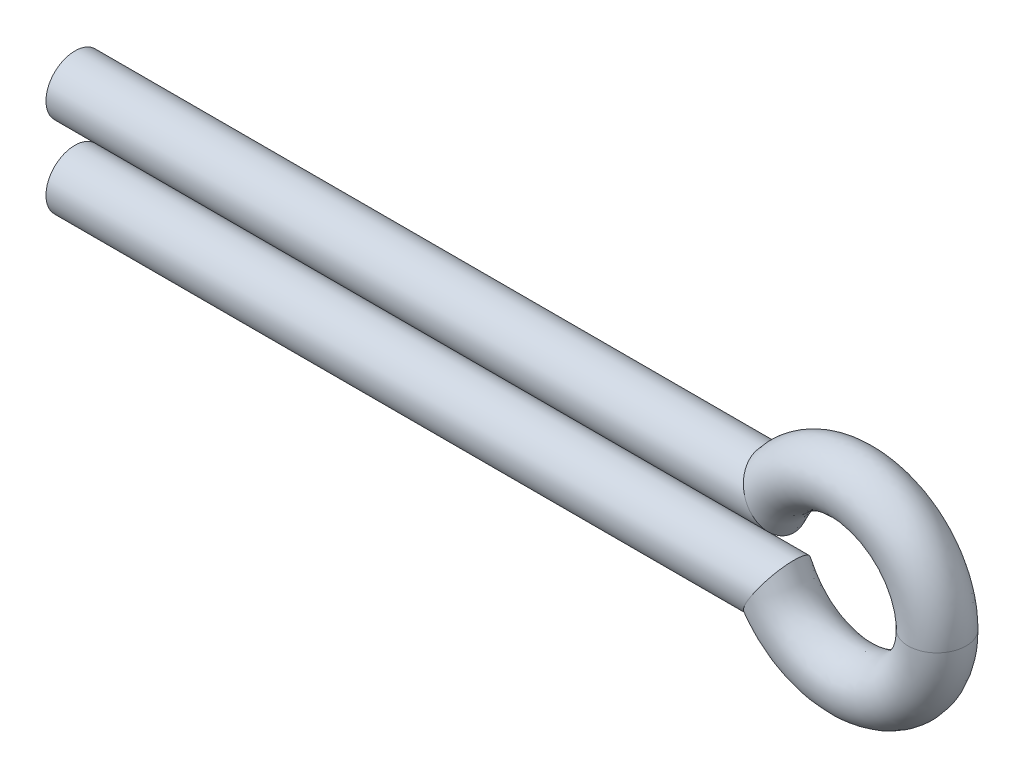
from build123d import *

# Parameters (mm, degrees)
SWEEP2_PROFILE_R = 5


with BuildPart() as part:
    # Sweep2: sweep along a path in Sketch1
    with BuildLine(Plane.XY) as sweep2_path:
        Line((-53.984339727, 28.562623383), (67.313554908, 28.562623383))
        ThreePointArc((67.313554908, 28.562623383), (95.060814118, 21.504287062), (67.313554908, 14.44595074))
        Line((67.313554908, 14.44595074), (-53.984339727, 14.44595074))
    # Sweep2 profile (on start of the path) → Sweep2 (sweep)
    with BuildSketch(Plane(origin=(-53.984339727, 28.562623383, 0), x_dir=(0, 0, 1), z_dir=(1, 0, 0))):
        Circle(SWEEP2_PROFILE_R)
    sweep(path=sweep2_path.line, transition=Transition.RIGHT)


solid = part.part
